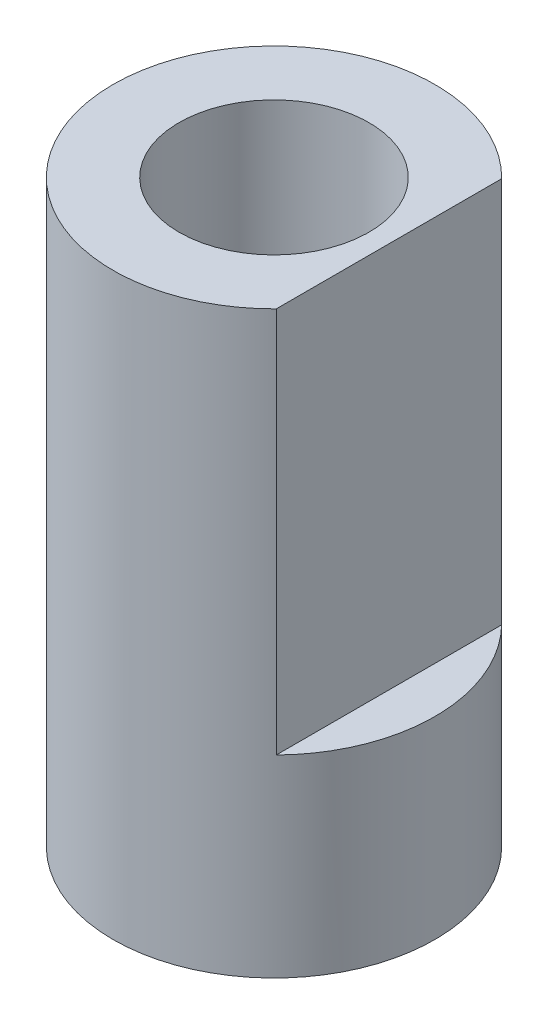
from build123d import *

# Parameters (mm, degrees)
SKETCH1_R           = 1.475
BOSS_EXTRUDE4_DEPTH = 3
BOSS_EXTRUDE5_START = 3
SKETCH1_3_R         = 1.475
BOSS_EXTRUDE5_DEPTH = 6


with BuildPart() as part:
    # Sketch1 → Boss-Extrude4 (new body)
    # profile 1 of 2: a face of its own
    with BuildSketch(Plane(origin=(0, 0, 0), x_dir=(1, 0, 0), z_dir=(0, 1, 0))):
        with BuildLine():
            ThreePointArc((1.785357107, 1.75), (-2.5, 0), (1.785357107, -1.75))
            Line((1.785357107, -1.75), (1.785357107, 1.75))
        make_face()
        with Locations(Location((0, 0, 0), (0, 0, 270))):
            Circle(SKETCH1_R, mode=Mode.SUBTRACT)
    # profile 2 of 2: a face of its own
    with BuildSketch(Plane(origin=(0, 0, 0), x_dir=(1, 0, 0), z_dir=(0, 1, 0))):
        with BuildLine():
            Line((1.785357107, 1.75), (1.785357107, -1.75))
            ThreePointArc((1.785357107, -1.75), (2.314453798, -0.945147404), (2.5, 0))
            ThreePointArc((2.5, 0), (2.314453798, 0.945147404), (1.785357107, 1.75))
        make_face()
    extrude(amount=BOSS_EXTRUDE4_DEPTH)

    # Sketch1<3> → Boss-Extrude5 (add)
    with BuildSketch(Plane(origin=(0, 0, 0), x_dir=(1, 0, 0), z_dir=(0, 1, 0)).offset(BOSS_EXTRUDE5_START)):
        with BuildLine():
            ThreePointArc((1.785357107, 1.75), (-2.5, 0), (1.785357107, -1.75))
            Line((1.785357107, -1.75), (1.785357107, 1.75))
        make_face()
        with Locations(Location((0, 0, 0), (0, 0, 270))):
            Circle(SKETCH1_3_R, mode=Mode.SUBTRACT)
    extrude(amount=BOSS_EXTRUDE5_DEPTH)


solid = part.part
